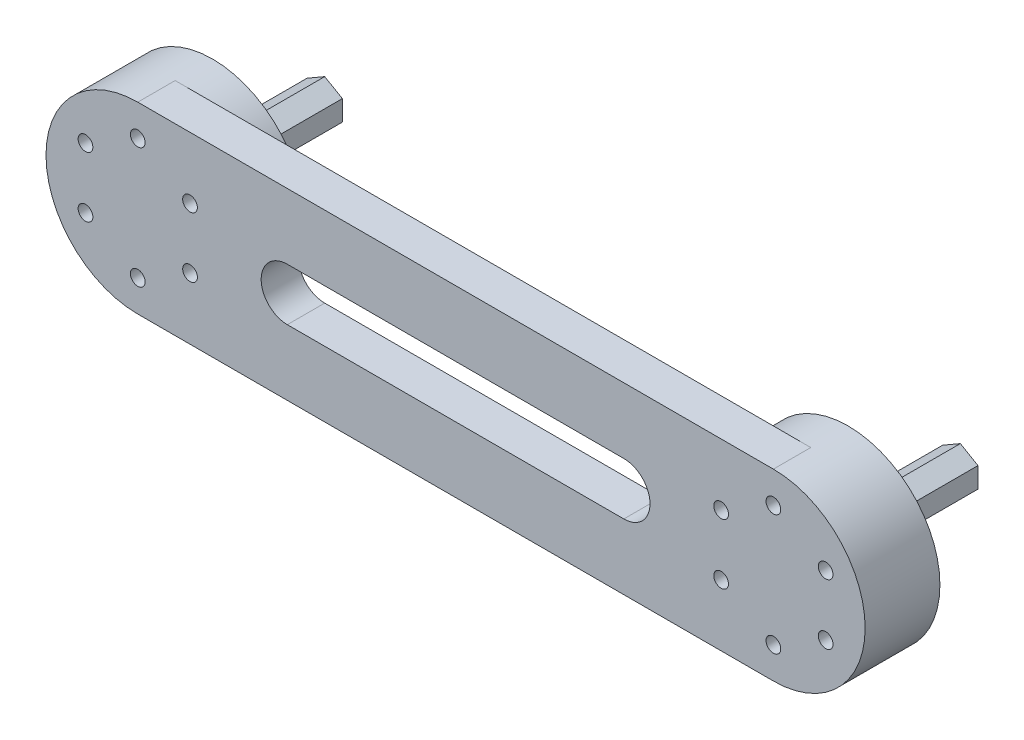
from build123d import *

# Parameters (mm, degrees)
SKETCH1_R                = 15.584715873
SKETCH1_R_2              = 1.25
BOSS_EXTRUDE5_DEPTH      = 6.35
BOSS_EXTRUDE6_START      = -6.35
SKETCH1_7_R              = 15.584715873
SKETCH1_7_R_2            = 1.25
BOSS_EXTRUDE6_DEPTH      = 6.35
BOSS_EXTRUDE7_DEPTH      = 6.35
BOSS_EXTRUDE7_DEPTH_BACK = 25.4


with BuildPart() as part:
    # Sketch1 → Boss-Extrude5 (new body)
    # profile 1 of 3: a face of its own
    with BuildSketch(Plane.XY):
        with BuildLine():
            Line((21.23324901, 27.290268066), (-86.71675099, 27.290268066))
            ThreePointArc((-86.71675099, 27.290268066), (-75.696692713, 22.72561047), (-71.132035117, 11.705552193))
            ThreePointArc((-71.132035117, 11.705552193), (-75.696692713, 0.685493916), (-86.71675099, -3.879163681))
            Line((-86.71675099, -3.879163681), (21.23324901, -3.879163681))
            ThreePointArc((21.23324901, -3.879163681), (5.648533136, 11.705552193), (21.23324901, 27.290268066))
        make_face()
        with BuildLine():
            ThreePointArc((-61.31675099, 7.260552193), (-65.76175099, 11.705552193), (-61.31675099, 16.150552193))
            Line((-61.31675099, 16.150552193), (-4.16675099, 16.150552193))
            ThreePointArc((-4.16675099, 16.150552193), (0.27824901, 11.705552193), (-4.16675099, 7.260552193))
            Line((-4.16675099, 7.260552193), (-61.31675099, 7.260552193))
        make_face(mode=Mode.SUBTRACT)
    # profile 2 of 3: a face of its own
    with BuildSketch(Plane.XY):
        with Locations((-86.71675099, 11.705552193)):
            Circle(SKETCH1_R)
        with Locations((-77.839990601, 16.830552193)):
            Circle(SKETCH1_R_2, mode=Mode.SUBTRACT)
        with Locations((-77.839990601, 6.580552193)):
            Circle(SKETCH1_R_2, mode=Mode.SUBTRACT)
        with Locations((-86.71675099, 1.455552193)):
            Circle(SKETCH1_R_2, mode=Mode.SUBTRACT)
        with Locations((-95.593511379, 6.580552193)):
            Circle(SKETCH1_R_2, mode=Mode.SUBTRACT)
        with Locations((-95.593511379, 16.830552193)):
            Circle(SKETCH1_R_2, mode=Mode.SUBTRACT)
        with Locations((-86.71675099, 21.955552193)):
            Circle(SKETCH1_R_2, mode=Mode.SUBTRACT)
        Polygon((-89.71675099, 9.973501385), (-89.71675099, 13.437603), (-86.71675099, 15.169653808), (-83.71675099, 13.437603), (-83.71675099, 9.973501385), (-86.71675099, 8.241450578), align=None, mode=Mode.SUBTRACT)
    # profile 3 of 3: a face of its own
    with BuildSketch(Plane.XY):
        with BuildLine():
            ThreePointArc((36.817964883, 11.705552193), (32.253307287, 22.72561047), (21.23324901, 27.290268066))
            ThreePointArc((21.23324901, 27.290268066), (5.648533136, 11.705552193), (21.23324901, -3.879163681))
            ThreePointArc((21.23324901, -3.879163681), (32.253307287, 0.685493916), (36.817964883, 11.705552193))
        make_face()
        with Locations((21.23324901, 1.455552193)):
            Circle(SKETCH1_R_2, mode=Mode.SUBTRACT)
        with Locations((12.356488621, 6.580552193)):
            Circle(SKETCH1_R_2, mode=Mode.SUBTRACT)
        with Locations((30.110009399, 6.580552193)):
            Circle(SKETCH1_R_2, mode=Mode.SUBTRACT)
        Polygon((21.23324901, 15.169653808), (24.23324901, 13.437603), (24.23324901, 9.973501385), (21.23324901, 8.241450578), (18.23324901, 9.973501385), (18.23324901, 13.437603), align=None, mode=Mode.SUBTRACT)
        with Locations((12.356488621, 16.830552193)):
            Circle(SKETCH1_R_2, mode=Mode.SUBTRACT)
        with Locations((30.110009399, 16.830552193)):
            Circle(SKETCH1_R_2, mode=Mode.SUBTRACT)
        with Locations((21.23324901, 21.955552193)):
            Circle(SKETCH1_R_2, mode=Mode.SUBTRACT)
    extrude(amount=BOSS_EXTRUDE5_DEPTH)

    # Sketch1<7> → Boss-Extrude6 (add)
    # profile 1 of 2: a face of its own
    with BuildSketch(Plane.XY.offset(BOSS_EXTRUDE6_START)):
        with Locations(Location((-86.71675099, 11.705552193, 0), (0, 0, 90))):
            Circle(SKETCH1_7_R)
        with Locations((-77.839990601, 16.830552193)):
            Circle(SKETCH1_7_R_2, mode=Mode.SUBTRACT)
        with Locations((-77.839990601, 6.580552193)):
            Circle(SKETCH1_7_R_2, mode=Mode.SUBTRACT)
        with Locations((-86.71675099, 1.455552193)):
            Circle(SKETCH1_7_R_2, mode=Mode.SUBTRACT)
        with Locations((-95.593511379, 6.580552193)):
            Circle(SKETCH1_7_R_2, mode=Mode.SUBTRACT)
        with Locations((-95.593511379, 16.830552193)):
            Circle(SKETCH1_7_R_2, mode=Mode.SUBTRACT)
        with Locations((-86.71675099, 21.955552193)):
            Circle(SKETCH1_7_R_2, mode=Mode.SUBTRACT)
        Polygon((-89.71675099, 9.973501385), (-89.71675099, 13.437603), (-86.71675099, 15.169653808), (-83.71675099, 13.437603), (-83.71675099, 9.973501385), (-86.71675099, 8.241450578), align=None, mode=Mode.SUBTRACT)
    # profile 2 of 2: a face of its own
    with BuildSketch(Plane.XY.offset(BOSS_EXTRUDE6_START)):
        with BuildLine():
            ThreePointArc((36.817964883, 11.705552193), (32.253307287, 22.72561047), (21.23324901, 27.290268066))
            ThreePointArc((21.23324901, 27.290268066), (5.648533136, 11.705552193), (21.23324901, -3.879163681))
            ThreePointArc((21.23324901, -3.879163681), (32.253307287, 0.685493916), (36.817964883, 11.705552193))
        make_face()
        with Locations((21.23324901, 1.455552193)):
            Circle(SKETCH1_7_R_2, mode=Mode.SUBTRACT)
        with Locations((12.356488621, 6.580552193)):
            Circle(SKETCH1_7_R_2, mode=Mode.SUBTRACT)
        with Locations((30.110009399, 6.580552193)):
            Circle(SKETCH1_7_R_2, mode=Mode.SUBTRACT)
        Polygon((21.23324901, 15.169653808), (24.23324901, 13.437603), (24.23324901, 9.973501385), (21.23324901, 8.241450578), (18.23324901, 9.973501385), (18.23324901, 13.437603), align=None, mode=Mode.SUBTRACT)
        with Locations((12.356488621, 16.830552193)):
            Circle(SKETCH1_7_R_2, mode=Mode.SUBTRACT)
        with Locations((30.110009399, 16.830552193)):
            Circle(SKETCH1_7_R_2, mode=Mode.SUBTRACT)
        with Locations((21.23324901, 21.955552193)):
            Circle(SKETCH1_7_R_2, mode=Mode.SUBTRACT)
    extrude(amount=BOSS_EXTRUDE6_DEPTH)

    # Sketch1<8> → Boss-Extrude7 (add, two sides: drawn at the far end of the back side and taken through both)
    with BuildSketch(Plane.XY.offset(-BOSS_EXTRUDE7_DEPTH_BACK)):
        Polygon((-86.71675099, 15.169653808), (-83.71675099, 13.437603), (-83.71675099, 9.973501385), (-86.71675099, 8.241450578), (-89.71675099, 9.973501385), (-89.71675099, 13.437603), align=None)
        Polygon((24.23324901, 13.437603), (21.23324901, 15.169653808), (18.23324901, 13.437603), (18.23324901, 9.973501385), (21.23324901, 8.241450578), (24.23324901, 9.973501385), align=None)
    extrude(amount=BOSS_EXTRUDE7_DEPTH + BOSS_EXTRUDE7_DEPTH_BACK)


solid = part.part
